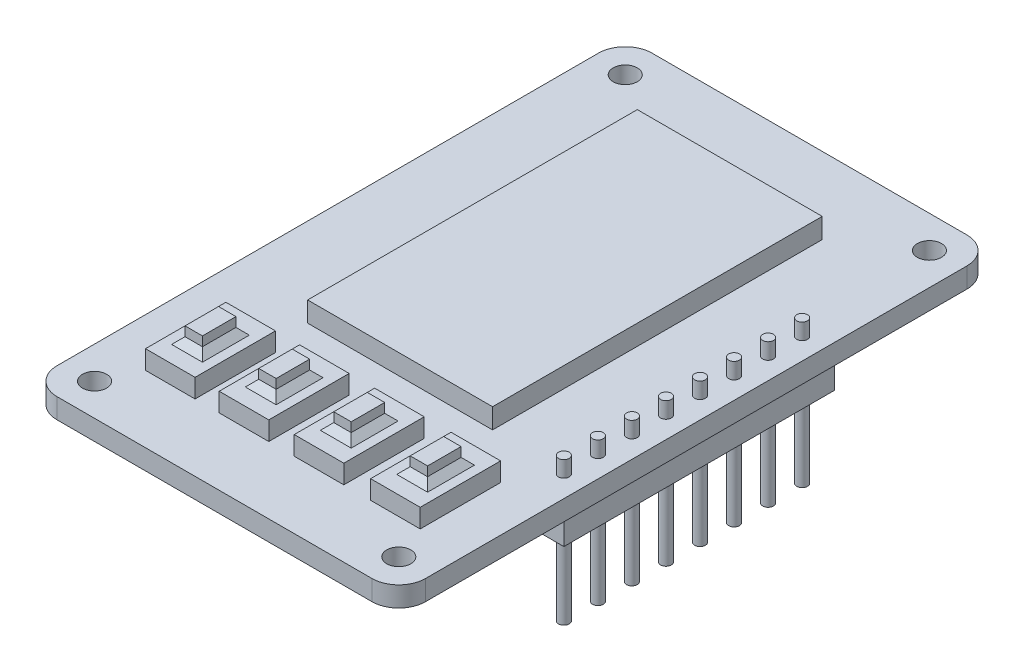
from build123d import *

# Parameters (mm, degrees)
SKETCH_1_R           = 0.9
EXTRUDE_1_DEPTH      = 1.5
SKETCH_2_W           = 13.8
SKETCH_2_H           = 24.6
EXTRUDE_2_DEPTH      = 1.5
SKETCH_3_W           = 3.7
SKETCH_3_H           = 6
EXTRUDE_3_DEPTH      = 1.4
SKETCH_4_W           = 1.3
SKETCH_4_H           = 2.5
EXTRUDE_4_DEPTH      = 1.2
CHAMFER_1_SIZE       = 0.5
EXTRUDE_5_DEPTH      = 1.2
EXTRUDE_5_DEPTH_BACK = 9.5
SKETCH_5_R           = 0.4
SKETCH_6_W           = 2.4
SKETCH_6_H           = 20.18
SKETCH_6_R           = 0.4
EXTRUDE_6_DEPTH      = 2


with BuildPart() as part:
    # Эскиз1 → Бобышка-Вытянуть1 (new body)
    with BuildSketch(Plane(origin=(0, 0, 0), x_dir=(1, 0, 0), z_dir=(0, 1, 0))):
        with BuildLine():
            Line((11.75, 22.2), (-11.75, 22.2))
            ThreePointArc((-11.75, 22.2), (-13.164213562, 21.614213562), (-13.75, 20.2))
            Line((-13.75, 20.2), (-13.75, -20.2))
            ThreePointArc((-13.75, -20.2), (-13.164213562, -21.614213562), (-11.75, -22.2))
            Line((-11.75, -22.2), (11.75, -22.2))
            ThreePointArc((11.75, -22.2), (13.164213562, -21.614213562), (13.75, -20.2))
            Line((13.75, -20.2), (13.75, 20.2))
            ThreePointArc((13.75, 20.2), (13.164213562, 21.614213562), (11.75, 22.2))
        make_face()
        with Locations(Location((11.35, 19.8, 0), (0, 0, 270))):
            Circle(SKETCH_1_R, mode=Mode.SUBTRACT)
        with Locations(Location((-11.35, 19.8, 0), (0, 0, 270))):
            Circle(SKETCH_1_R, mode=Mode.SUBTRACT)
        with Locations(Location((-11.35, -19.8, 0), (0, 0, 90))):
            Circle(SKETCH_1_R, mode=Mode.SUBTRACT)
        with Locations(Location((11.35, -19.8, 0), (0, 0, 90))):
            Circle(SKETCH_1_R, mode=Mode.SUBTRACT)
    extrude(amount=EXTRUDE_1_DEPTH)

    # Эскиз2 → Бобышка-Вытянуть2 (add)
    with BuildSketch(Plane(origin=(0, 1.5, 0), x_dir=(1, 0, 0), z_dir=(0, 1, 0))):
        with Locations((-0.25, 4.2)):
            Rectangle(SKETCH_2_W, SKETCH_2_H)
    extrude(amount=EXTRUDE_2_DEPTH)

    # Эскиз3 → Бобышка-Вытянуть3 (add)
    with BuildSketch(Plane(origin=(0, 1.5, 0), x_dir=(1, 0, 0), z_dir=(0, 1, 0))):
        with Locations((8.5, -14.2)):
            Rectangle(SKETCH_3_W, SKETCH_3_H)
        with Locations((2.8, -14.2)):
            Rectangle(SKETCH_3_W, SKETCH_3_H)
        with Locations((-2.8, -14.2)):
            Rectangle(SKETCH_3_W, SKETCH_3_H)
        with Locations((-8.3, -14.2)):
            Rectangle(SKETCH_3_W, SKETCH_3_H)
    extrude(amount=EXTRUDE_3_DEPTH)

    # Эскиз4 → Бобышка-Вытянуть4 (add)
    with BuildSketch(Plane(origin=(0, 2.9, 0), x_dir=(1, 0, 0), z_dir=(0, 1, 0))):
        with Locations((8.5, -14.2)):
            Rectangle(SKETCH_4_W, SKETCH_4_H)
        with Locations((2.8, -14.2)):
            Rectangle(SKETCH_4_W, SKETCH_4_H)
        with Locations((-2.8, -14.2)):
            Rectangle(SKETCH_4_W, SKETCH_4_H)
        with Locations((-8.3, -14.2)):
            Rectangle(SKETCH_4_W, SKETCH_4_H)
    extrude(amount=EXTRUDE_4_DEPTH)

    # Фаска1
    chamfer_1_edges = [part.edges().sort_by_distance(p)[0] for p in [
        (9.15, 2.9, 14.2),
        (8.5, 2.9, 12.95),
        (7.85, 2.9, 14.2),
        (8.5, 2.9, 15.45),
        (2.8, 2.9, 12.95),
        (2.15, 2.9, 14.2),
        (2.8, 2.9, 15.45),
        (3.45, 2.9, 14.2),
        (-2.8, 2.9, 12.95),
        (-3.45, 2.9, 14.2),
        (-2.8, 2.9, 15.45),
        (-2.15, 2.9, 14.2),
        (-8.3, 2.9, 12.95),
        (-8.95, 2.9, 14.2),
        (-8.3, 2.9, 15.45),
        (-7.65, 2.9, 14.2),
    ]]
    chamfer(chamfer_1_edges, length=CHAMFER_1_SIZE)

    # Эскиз5 → Бобышка-Вытянуть5 (add, two sides: drawn at the far end of the back side and taken through both)
    with BuildSketch(Plane(origin=(0, 1.5, 0), x_dir=(1, 0, 0), z_dir=(0, 1, 0)).offset(-EXTRUDE_5_DEPTH_BACK)):
        with Locations(Location((12.15, 9.5, 0), (0, 0, 270))):
            Circle(SKETCH_5_R)
        with Locations(Location((12.15, 6.96, 0), (0, 0, 270))):
            Circle(SKETCH_5_R)
        with Locations(Location((12.15, 4.42, 0), (0, 0, 270))):
            Circle(SKETCH_5_R)
        with Locations(Location((12.15, 1.88, 0), (0, 0, 270))):
            Circle(SKETCH_5_R)
        with Locations(Location((12.15, -0.66, 0), (0, 0, 270))):
            Circle(SKETCH_5_R)
        with Locations(Location((12.15, -3.2, 0), (0, 0, 270))):
            Circle(SKETCH_5_R)
        with Locations(Location((12.15, -5.74, 0), (0, 0, 270))):
            Circle(SKETCH_5_R)
        with Locations(Location((12.15, -8.28, 0), (0, 0, 270))):
            Circle(SKETCH_5_R)
    extrude(amount=EXTRUDE_5_DEPTH + EXTRUDE_5_DEPTH_BACK)

    # Эскиз6 → Бобышка-Вытянуть6 (add)
    with BuildSketch(Plane.XZ):
        with Locations((12.15, -0.61)):
            Rectangle(SKETCH_6_W, SKETCH_6_H)
        with Locations(Location((12.15, -9.5, 0), (0, 0, 90))):
            Circle(SKETCH_6_R, mode=Mode.SUBTRACT)
        with Locations(Location((12.15, -6.96, 0), (0, 0, 90))):
            Circle(SKETCH_6_R, mode=Mode.SUBTRACT)
        with Locations(Location((12.15, -4.42, 0), (0, 0, 90))):
            Circle(SKETCH_6_R, mode=Mode.SUBTRACT)
        with Locations(Location((12.15, -1.88, 0), (0, 0, 90))):
            Circle(SKETCH_6_R, mode=Mode.SUBTRACT)
        with Locations(Location((12.15, 0.66, 0), (0, 0, 90))):
            Circle(SKETCH_6_R, mode=Mode.SUBTRACT)
        with Locations(Location((12.15, 3.2, 0), (0, 0, 90))):
            Circle(SKETCH_6_R, mode=Mode.SUBTRACT)
        with Locations(Location((12.15, 5.74, 0), (0, 0, 90))):
            Circle(SKETCH_6_R, mode=Mode.SUBTRACT)
        with Locations(Location((12.15, 8.28, 0), (0, 0, 90))):
            Circle(SKETCH_6_R, mode=Mode.SUBTRACT)
    extrude(amount=EXTRUDE_6_DEPTH)


solid = part.part
